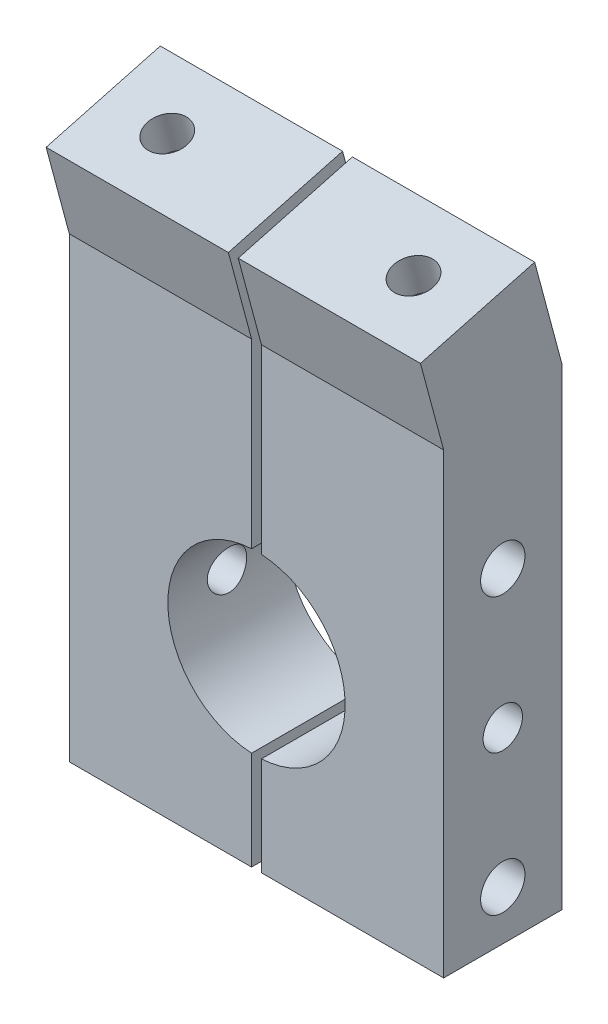
from build123d import *

# Parameters (mm, degrees)
SKETCH1_W               = 38
SKETCH1_H               = 48
SKETCH1_R               = 9
BOSS_EXTRUDE1_DEPTH     = 12
CUT_EXTRUDE1_DEPTH      = 33.878564446
CUT_EXTRUDE1_DEPTH_BACK = 33.878564446
SKETCH2_R               = 2.25
SKETCH2_R_2             = 2
SKETCH5_W               = 2.7
SKETCH5_H               = 7.5
CUT_EXTRUDE4_DEPTH      = 9.75
BOSS_EXTRUDE2_DEPTH     = 19
SKETCH4_W               = 1
SKETCH4_H               = 58.312792412
CUT_EXTRUDE3_DEPTH      = 42.766217609
SKETCH7_R               = 2
CUT_EXTRUDE5_DEPTH      = 12
SKETCH8_W               = 7.5
SKETCH8_H               = 2.2
CUT_EXTRUDE6_DEPTH      = 9.75


with BuildPart() as part:
    # Sketch1 → Boss-Extrude1 (new body)
    with BuildSketch(Plane.XY):
        Rectangle(SKETCH1_W, SKETCH1_H)
        with Locations((0, -5)):
            Circle(SKETCH1_R, mode=Mode.SUBTRACT)
    extrude(amount=BOSS_EXTRUDE1_DEPTH)

    # Sketch2 → Cut-Extrude1 (cut, two sides: drawn at the far end of the back side and taken through both)
    with BuildSketch(Plane(origin=(0, 0, 0), x_dir=(0, 0, -1), z_dir=(1, 0, 0)).offset(-CUT_EXTRUDE1_DEPTH_BACK)):
        with Locations((-6, -19)):
            Circle(SKETCH2_R)
        with Locations((-6, -5)):
            Circle(SKETCH2_R_2)
        with Locations((-6, 9)):
            Circle(SKETCH2_R)
    extrude(amount=CUT_EXTRUDE1_DEPTH + CUT_EXTRUDE1_DEPTH_BACK, mode=Mode.SUBTRACT)

    # Sketch5 → Cut-Extrude4 (cut)
    with BuildSketch(Plane.XY):
        with Locations((14, -5)):
            Rectangle(SKETCH5_W, SKETCH5_H)
        with Locations((-14, -5)):
            Rectangle(SKETCH5_W, SKETCH5_H)
    extrude(amount=CUT_EXTRUDE4_DEPTH, mode=Mode.SUBTRACT)

    # Sketch6 → Boss-Extrude2 (add, symmetric)
    with BuildSketch(Plane(origin=(0, 0, 0), x_dir=(0, 0, -1), z_dir=(1, 0, 0))):
        Polygon((0, 24), (-2.763304398, 34.312792412), (-14.354414314, 31.20696387), (-12, 22.420170029), (-12, 24), align=None)
    extrude(amount=BOSS_EXTRUDE2_DEPTH, both=True)

    # Sketch4 → Cut-Extrude3 (cut, through all)
    with BuildSketch(Plane.XY):
        with Locations((0, 5.156396206)):
            Rectangle(SKETCH4_W, SKETCH4_H)
    extrude(amount=CUT_EXTRUDE3_DEPTH, mode=Mode.SUBTRACT)


with BuildPart() as cut_extrude3_piece_1:
    # of the separate pieces the step leaves, piece 1, a body of its own (cut_extrude3_pieces)
    add(part.part.solids().sort_by_distance((-19, -24, 0))[0])


with BuildPart() as cut_extrude3_piece_2:
    # of the separate pieces the step leaves, piece 2, a body of its own (cut_extrude3_pieces)
    add(part.part.solids().sort_by_distance((19, -24, 0))[0])


with BuildPart() as cut_extrude5_tool:
    # Sketch7 → Cut-Extrude5 (new body)
    with BuildSketch(Plane(origin=(0, 32.705097257, 8.763304398), x_dir=(1, 0, 0), z_dir=(0, 0.9659258262890681, 0.2588190451025213))):
        with Locations(Location((-12.5, 0.211657082, 0), (0, 0, 270))):
            Circle(SKETCH7_R)
        with Locations(Location((12.5, 0.211657082, 0), (0, 0, 270))):
            Circle(SKETCH7_R)
    extrude(amount=-CUT_EXTRUDE5_DEPTH)


with BuildPart() as cut_extrude3_piece_1_1:
    add(cut_extrude3_piece_1.part)

    # Cut-Extrude5: cut by cut_extrude5_tool
    add(cut_extrude5_tool.part, mode=Mode.SUBTRACT)


with BuildPart() as cut_extrude3_piece_2_1:
    add(cut_extrude3_piece_2.part)

    # Cut-Extrude5: cut by cut_extrude5_tool
    add(cut_extrude5_tool.part, mode=Mode.SUBTRACT)


with BuildPart() as cut_extrude6_tool:
    # Sketch8 → Cut-Extrude6 (new body)
    with BuildSketch(Plane(origin=(0, 1.607695155, -6), x_dir=(-1, 0, 0), z_dir=(0, 0.2588190451025215, -0.9659258262890681))):
        with Locations((-12.5, 28.858808168)):
            Rectangle(SKETCH8_W, SKETCH8_H)
        with Locations((12.5, 28.858808168)):
            Rectangle(SKETCH8_W, SKETCH8_H)
    extrude(amount=-CUT_EXTRUDE6_DEPTH)


with BuildPart() as cut_extrude3_piece_1_2:
    add(cut_extrude3_piece_1_1.part)

    # Cut-Extrude6: cut by cut_extrude6_tool
    add(cut_extrude6_tool.part, mode=Mode.SUBTRACT)


with BuildPart() as cut_extrude3_piece_2_2:
    add(cut_extrude3_piece_2_1.part)

    # Cut-Extrude6: cut by cut_extrude6_tool
    add(cut_extrude6_tool.part, mode=Mode.SUBTRACT)


solid = Compound([cut_extrude3_piece_1_2.part, cut_extrude3_piece_2_2.part])
